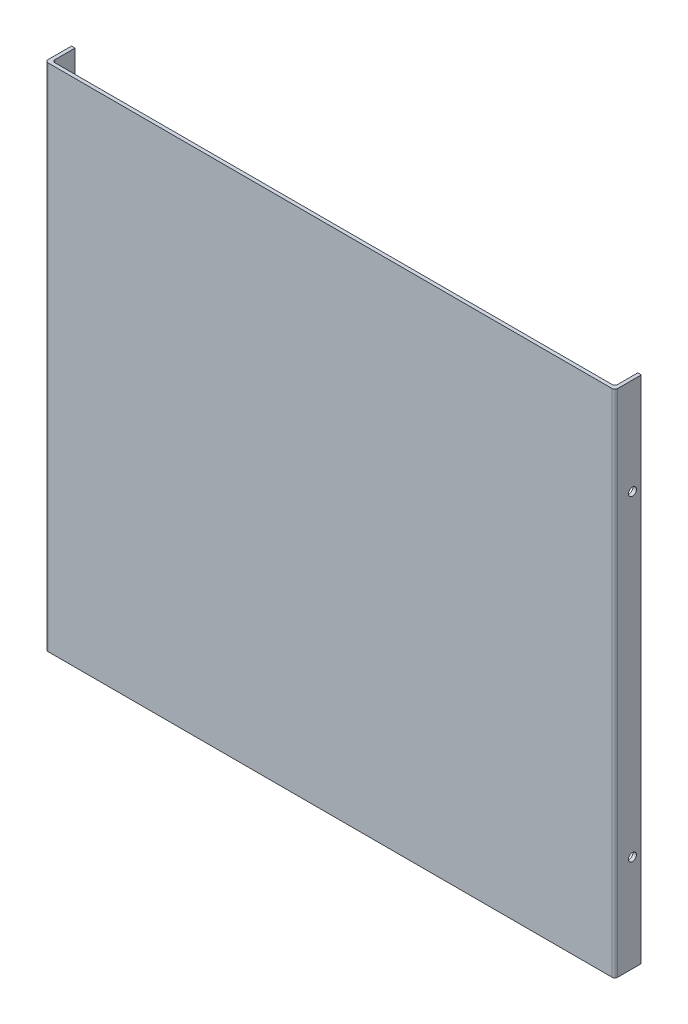
from build123d import *

# Parameters (mm, degrees)
ESQUISSE1_W           = 320
ESQUISSE1_H           = 290
BOSS_EXTRU_1_DEPTH    = 2
ESQUISSE2_W           = 15
ESQUISSE2_H           = 290
BOSS_EXTRU_2_DEPTH    = 2
CONG_1_R              = 1.5
CONG_1_OF_SYM_TRIE1_R = 1.5
D_GAGEMENT_M41_D      = 4.5


with BuildPart() as part:
    # Esquisse1 → Boss.-Extru.1 (new body)
    with BuildSketch(Plane.XY):
        Rectangle(ESQUISSE1_W, ESQUISSE1_H)
    extrude(amount=BOSS_EXTRU_1_DEPTH)

    # Esquisse2 → Boss.-Extru.2 (add)
    with BuildSketch(Plane.ZY.offset(160)):
        with Locations((-5.5, 0)):
            Rectangle(ESQUISSE2_W, ESQUISSE2_H)
    boss_extru_2 = extrude(amount=BOSS_EXTRU_2_DEPTH)

    # Congé1
    cong_1_edges = [part.edges().sort_by_distance(p)[0] for p in [
        (-160, 0, 0),
        (-162, 0, 2),
    ]]
    fillet(cong_1_edges, radius=CONG_1_R)

    # Symétrie1: Boss.-Extru.2 across plane
    add(boss_extru_2.mirror(Plane(origin=(0, 0, 0), x_dir=(0, 0, 1), z_dir=(1, 0, 0))))

    # Congé1 of Symétrie1
    cong_1_of_sym_trie1_edges = [part.edges().sort_by_distance(p)[0] for p in [
        (160, 0, 0),
        (162, 0, 2),
    ]]
    fillet(cong_1_of_sym_trie1_edges, radius=CONG_1_OF_SYM_TRIE1_R)

    # Dégagement M41 (through all)
    with Locations(Plane.ZY.offset(162)):
        with Locations((-8, -90), (-8, 90)):
            Hole(D_GAGEMENT_M41_D / 2)


solid = part.part
